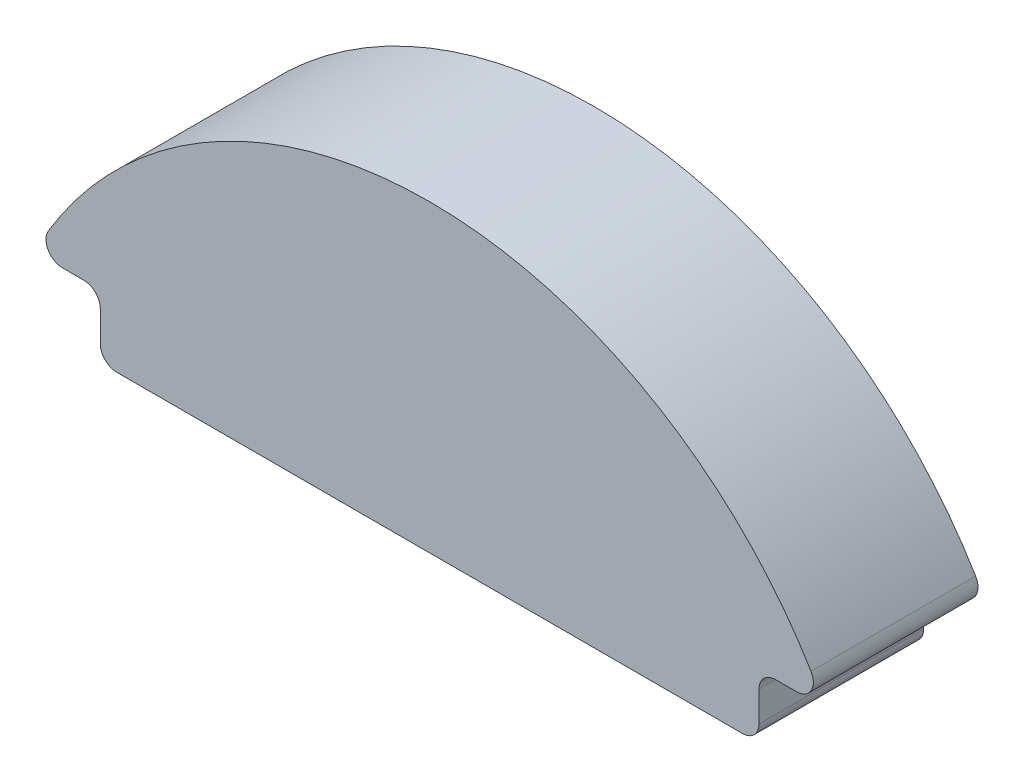
from build123d import *

# Parameters (mm, degrees)
BOSS_EXTRU_1_DEPTH = 50
COQUE1_T           = 2


with BuildPart() as part:
    # Esquisse1 → Boss.-Extru.1 (new body)
    with BuildSketch(Plane.XY):
        with BuildLine():
            Line((-79.110112943, 0), (110.889887057, 0))
            ThreePointArc((110.889887057, 0), (114.425420963, 1.464466094), (115.889887057, 5))
            Line((115.889887057, 5), (115.889887057, 14.2))
            ThreePointArc((115.889887057, 14.2), (117.354353151, 17.735533906), (120.889887057, 19.2))
            Line((120.889887057, 19.2), (127.386676949, 19.2))
            ThreePointArc((127.386676949, 19.2), (131.737258082, 21.735767095), (131.675015022, 26.771022476))
            ThreePointArc((131.675015022, 26.771022476), (15.889887057, 92.353415616), (-99.895240907, 26.771022476))
            ThreePointArc((-99.895240907, 26.771022476), (-99.957483967, 21.735767095), (-95.606902834, 19.2))
            Line((-95.606902834, 19.2), (-89.110112943, 19.2))
            ThreePointArc((-89.110112943, 19.2), (-85.574579037, 17.735533906), (-84.110112943, 14.2))
            Line((-84.110112943, 14.2), (-84.110112943, 5))
            ThreePointArc((-84.110112943, 5), (-82.645646849, 1.464466094), (-79.110112943, 0))
        make_face()
    extrude(amount=BOSS_EXTRU_1_DEPTH)

    # Coque1 (no face opened: a closed hollow body)
    add(offset(amount=-COQUE1_T, mode=Mode.PRIVATE), mode=Mode.SUBTRACT)


solid = part.part
